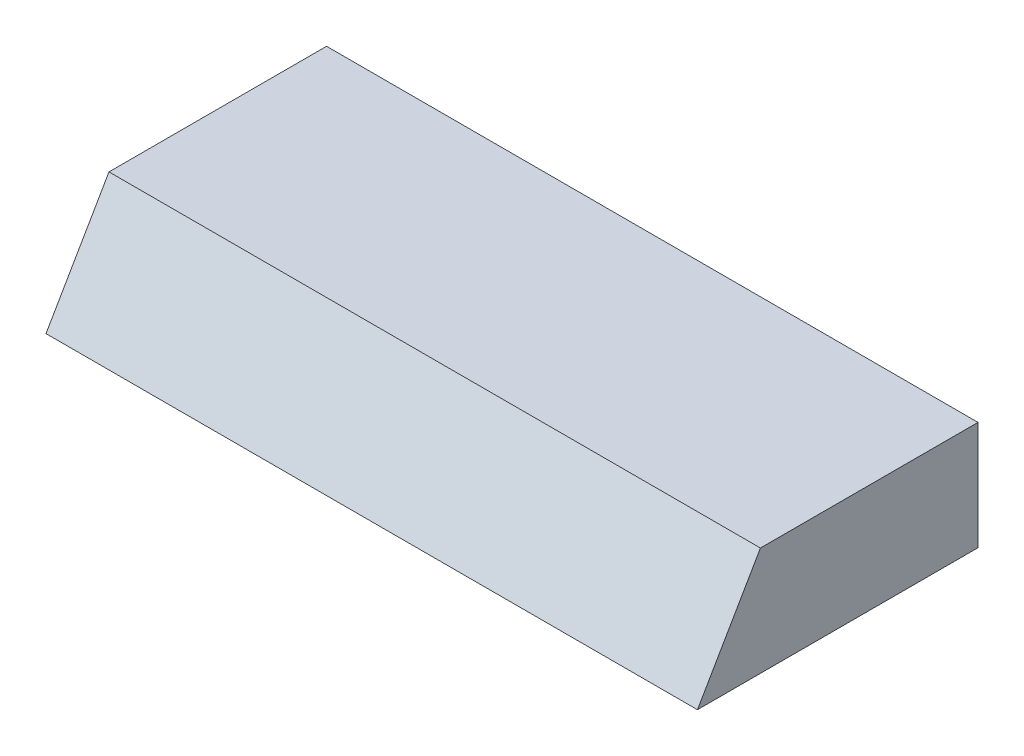
from build123d import *

# Parameters (mm, degrees)
SKETCH1_W           = 30
SKETCH1_H           = 5
BOSS_EXTRUDE1_DEPTH = 12.92
CUT_EXTRUDE1_DEPTH  = 36


with BuildPart() as part:
    # Sketch1 → Boss-Extrude1 (new body)
    with BuildSketch(Plane.XY):
        Rectangle(SKETCH1_W, SKETCH1_H)
    extrude(amount=BOSS_EXTRUDE1_DEPTH)

    # Sketch2 → Cut-Extrude1 (cut)
    with BuildSketch(Plane(origin=(15, 0, 0), x_dir=(0, 0, -1), z_dir=(1, 0, 0))):
        Polygon((-10.02, 2.5), (-12.92, -2.5), (-12.92, 2.5), align=None)
    extrude(amount=-CUT_EXTRUDE1_DEPTH, mode=Mode.SUBTRACT)


solid = part.part
